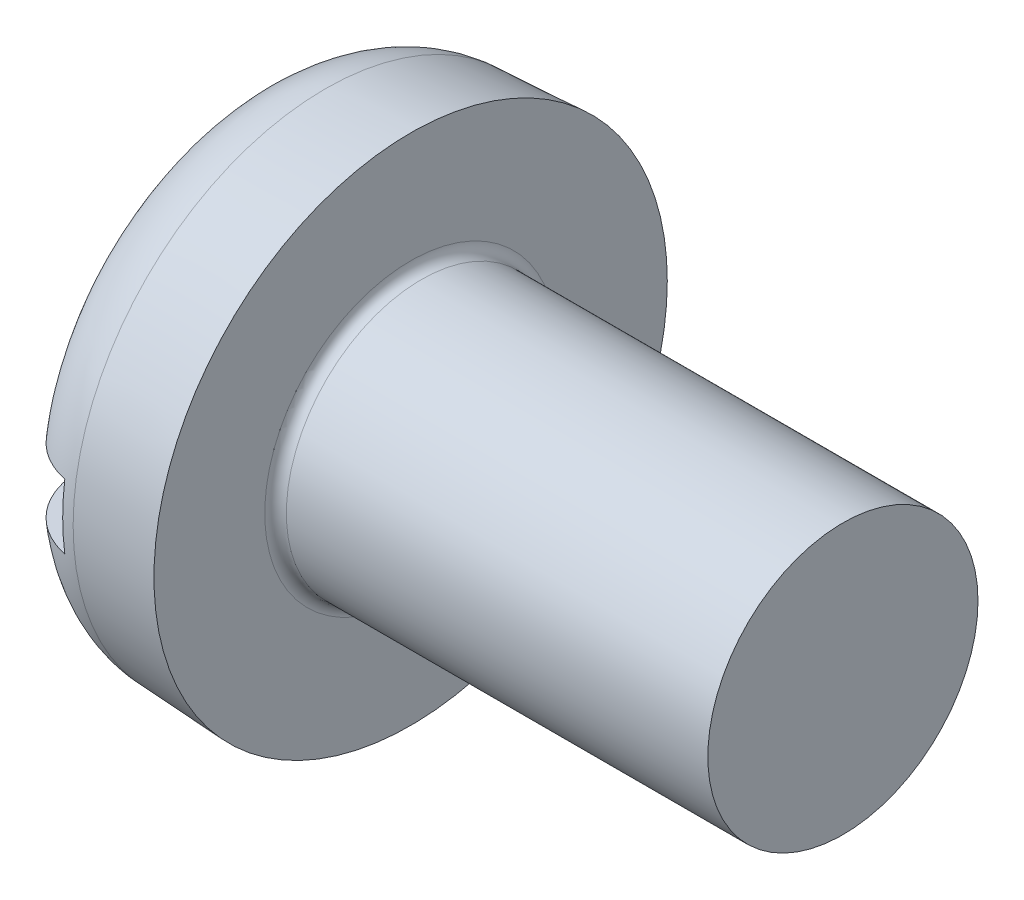
from build123d import *

# Parameters (mm, degrees)
SKETCH1_R        = 4.75
BASEHEAD_DEPTH   = 3
BASEHEAD_DRAFT   = -3
SKETCH2_R        = 2.5
BASEBODY_DEPTH   = 8
HEADFILLET2_R    = 1.5
NOTCH_DEPTH      = 13.458129876
NOTCH_DEPTH_BACK = 13.458129876
SKETCH3_W        = 1.2
SKETCH3_H        = 1.2
HEADFILLET1_R    = 0.2
SCALE_1_SCALE    = 0.25


with BuildPart() as part:
    # Sketch1 → BaseHead (with draft: the straight prism first)
    with BuildSketch(Plane(origin=(3, 0, 0), x_dir=(0, 0, -1), z_dir=(1, 0, 0))):
        Circle(SKETCH1_R)
    extrude(amount=-BASEHEAD_DEPTH)
    # BaseHead: the draft: its side faces are tilted about the plane it starts from
    basehead_sides = [part.faces().sort_by_distance(p)[0] for p in [
        (1.5, 0, 4.75),
    ]]
    draft(basehead_sides, Plane(origin=(3, 0, 0), x_dir=(0, 0, -1), z_dir=(1, 0, 0)), BASEHEAD_DRAFT)

    # Sketch2 → BaseBody (add)
    with BuildSketch(Plane(origin=(3, 0, 0), x_dir=(0, 0, -1), z_dir=(1, 0, 0))):
        Circle(SKETCH2_R)
    extrude(amount=BASEBODY_DEPTH)

    # HeadFillet2
    headfillet2_edges = [part.edges().sort_by_distance(p)[0] for p in [
        (0, 0, 4.592776662),
    ]]
    fillet(headfillet2_edges, radius=HEADFILLET2_R)

    # Sketch3 → Notch (cut, two sides: drawn at the far end of the back side and taken through both)
    with BuildSketch(Plane(origin=(1.05, -1.05, 0), x_dir=(0, -1, 0), z_dir=(0, 0, 1)).offset(-NOTCH_DEPTH_BACK)):
        with Locations((-1.05, -0.45)):
            Rectangle(SKETCH3_W, SKETCH3_H)
    extrude(amount=NOTCH_DEPTH + NOTCH_DEPTH_BACK, mode=Mode.SUBTRACT)

    # HeadFillet1
    headfillet1_edges = [part.edges().sort_by_distance(p)[0] for p in [
        (3, 0, 2.5),
    ]]
    fillet(headfillet1_edges, radius=HEADFILLET1_R)


with BuildPart() as part_1:
    # 缩放比例1: scaled about (0, 0, 0)
    add(part.part.scale(SCALE_1_SCALE))


solid = part_1.part
